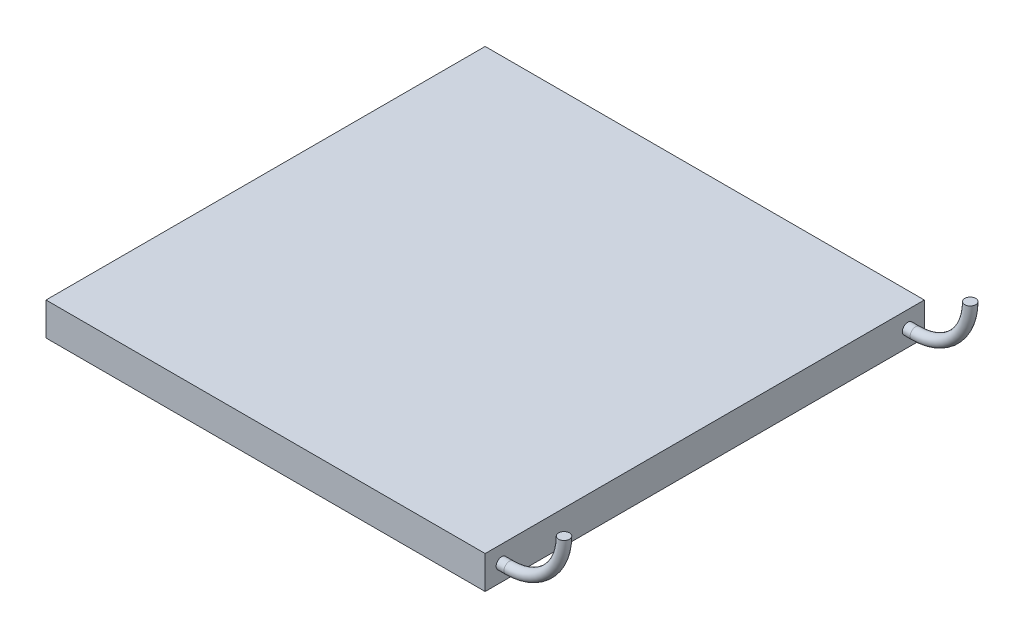
from build123d import *

# Parameters (mm, degrees)
SKETCH1_W           = 40
SKETCH1_H           = 40
BOSS_EXTRUDE1_DEPTH = 3
SKETCH2_R           = 0.5


with BuildPart() as part:
    # Sketch1 → Boss-Extrude1 (new body)
    with BuildSketch(Plane(origin=(0, 0, 0), x_dir=(1, 0, 0), z_dir=(0, 1, 0))):
        Rectangle(SKETCH1_W, SKETCH1_H)
    extrude(amount=BOSS_EXTRUDE1_DEPTH)

    # Sweep1: sweep along a path in Sketch3
    with BuildLine(Plane.XY.offset(18.5)) as sweep1_path:
        Line((20, 1.5), (20.711014952, 1.5))
        ThreePointArc((20.711014952, 1.5), (24.225698973, 2.955829789), (25.681528762, 6.47051381))
    # Sketch2 → Sweep1 (sweep)
    with BuildSketch(Plane(origin=(20, 0, 0), x_dir=(0, 0, -1), z_dir=(1, 0, 0))):
        with Locations((-18.5, 1.5)):
            Circle(SKETCH2_R)
    sweep1 = sweep(path=sweep1_path.line)

    # Mirror1: Sweep1 across plane
    add(sweep1.mirror(Plane.XY))


solid = part.part
